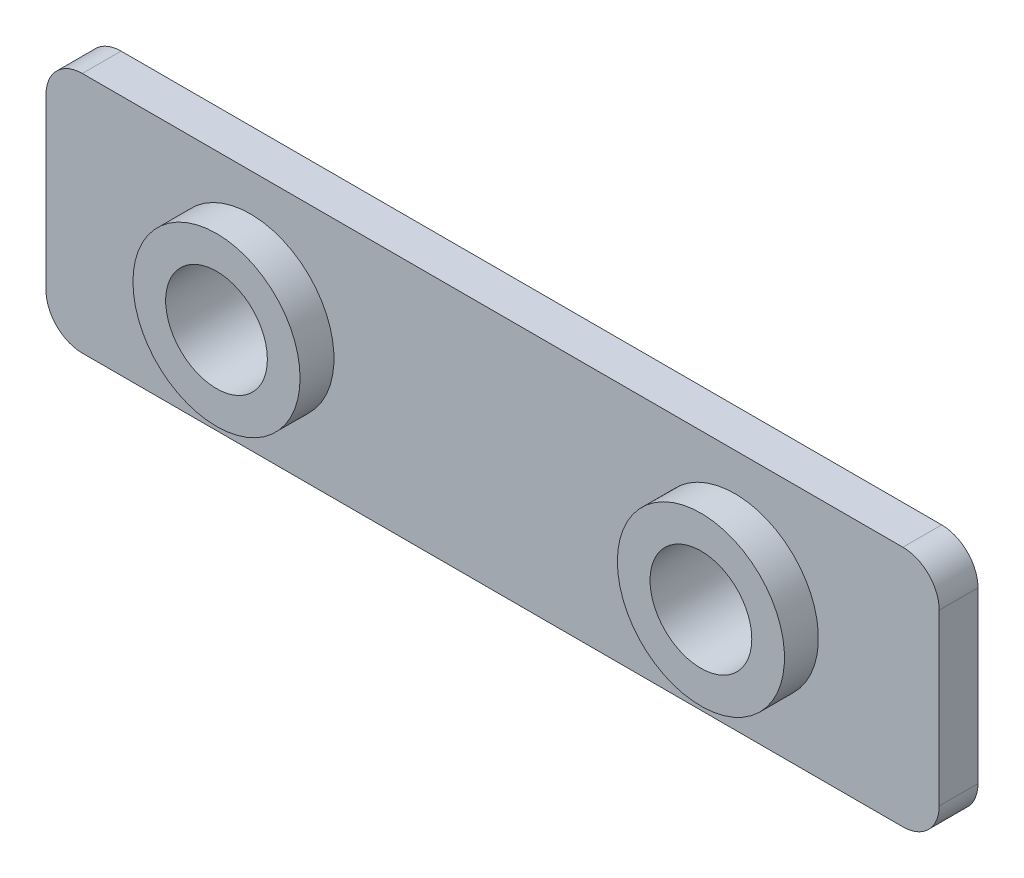
from build123d import *

# Parameters (mm, degrees)
BOSS_EXTRUDE1_DEPTH   = 1.6
SKETCH2_R             = 3.45
BOSS_EXTRUDE2_DEPTH   = 1.4
M5X0_8_TAPPED_HOLE1_D = 4.2


with BuildPart() as part:
    # Sketch1 → Boss-Extrude1 (new body)
    with BuildSketch(Plane.XY):
        with BuildLine():
            Line((-16.94, -5), (16.94, -5))
            ThreePointArc((16.94, -5), (18.000660172, -4.560660172), (18.44, -3.5))
            Line((18.44, -3.5), (18.44, 3.5))
            ThreePointArc((18.44, 3.5), (18.000660172, 4.560660172), (16.94, 5))
            Line((16.94, 5), (-16.94, 5))
            ThreePointArc((-16.94, 5), (-18.000660172, 4.560660172), (-18.44, 3.5))
            Line((-18.44, 3.5), (-18.44, -3.5))
            ThreePointArc((-18.44, -3.5), (-18.000660172, -4.560660172), (-16.94, -5))
        make_face()
    extrude(amount=BOSS_EXTRUDE1_DEPTH)

    # Sketch2 → Boss-Extrude2 (add)
    with BuildSketch(Plane.XY.offset(1.6)):
        with Locations(Location((-10, 0, 0), (0, 0, 180))):
            Circle(SKETCH2_R)
        with Locations(Location((10, 0, 0), (0, 0, 180))):
            Circle(SKETCH2_R)
    extrude(amount=BOSS_EXTRUDE2_DEPTH)

    # M5x0.8 Tapped Hole1 (through all)
    with Locations(Plane.XY.offset(3)):
        with Locations((-10, 0), (10, 0)):
            Hole(M5X0_8_TAPPED_HOLE1_D / 2)


solid = part.part
